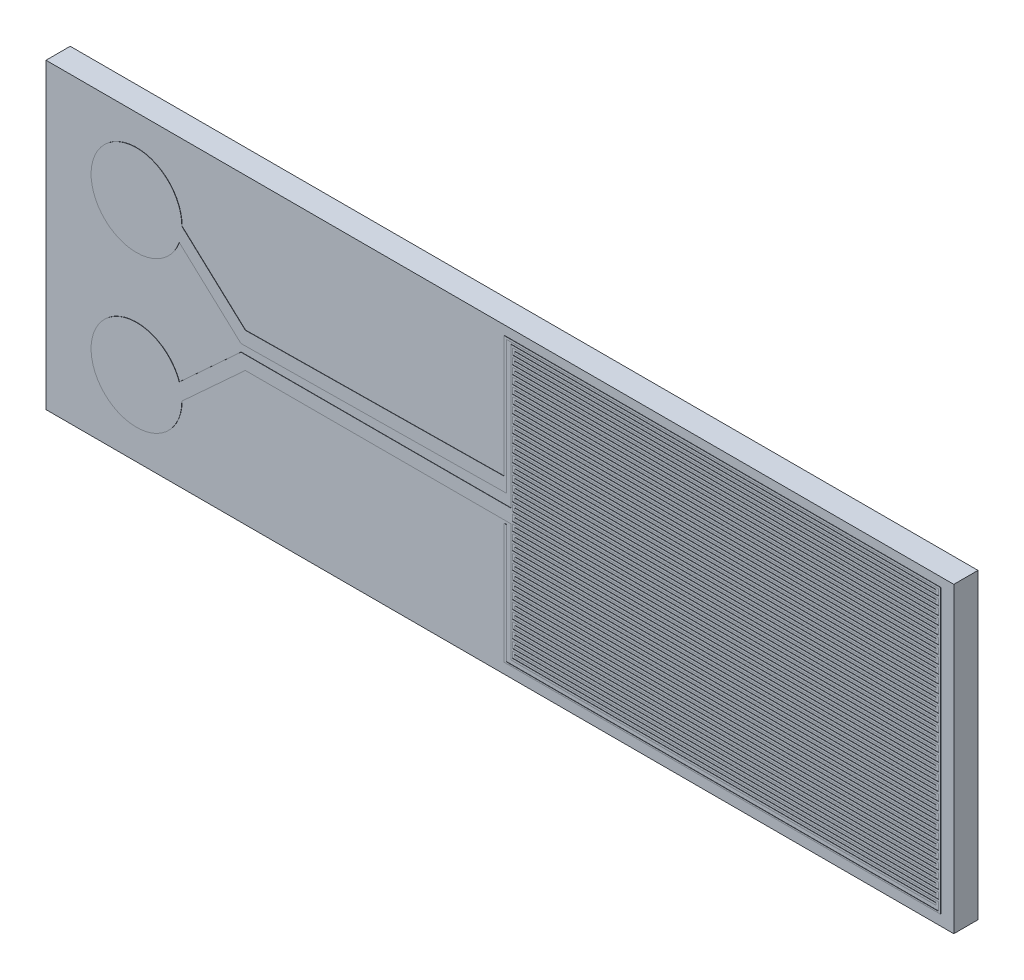
from build123d import *

# Parameters (mm, degrees)
SKETCH_1_W             = 30
SKETCH_1_H             = 10
EXTRUDE_1_DEPTH        = 0.8
SKETCH_2_W             = 14
SKETCH_2_H             = 0.07
EXTRUDE_2_DEPTH        = 0.01
PATTERN_LINEAR_1_COUNT = 33
PATTERN_LINEAR_1_PITCH = 0.28
SKETCH_3_W             = 14
SKETCH_3_H             = 0.07
EXTRUDE_3_DEPTH        = 0.01
PATTERN_LINEAR_2_COUNT = 33
PATTERN_LINEAR_2_PITCH = 0.28
EXTRUDE_4_DEPTH        = 0.01
EXTRUDE_5_DEPTH        = 0.01
EXTRUDE_7_DEPTH        = 0.01
SKETCH_10_W            = 0.01
SKETCH_10_H            = 0.350253409
SKETCH_10_H_2          = 0.1
CUT_EXTRUDE_2_DEPTH    = 0.1
SKETCH_11_R            = 0.65
CUT_EXTRUDE_4_DEPTH    = 32.632894272


with BuildPart() as part:
    # 草图1 → 凸台-拉伸1 (new body)
    with BuildSketch(Plane.XY):
        with Locations((15, 5)):
            Rectangle(SKETCH_1_W, SKETCH_1_H)
    extrude(amount=EXTRUDE_1_DEPTH)

    # 草图2 → 凸台-拉伸2 (add)
    with BuildSketch(Plane.XY.offset(0.8)):
        with Locations((22.5, 9.665)):
            Rectangle(SKETCH_2_W, SKETCH_2_H)
    extrude_2 = extrude(amount=EXTRUDE_2_DEPTH)

    # 阵列(线性)1: 凸台-拉伸2 ×33
    with Locations(*[(0, -i * PATTERN_LINEAR_1_PITCH, 0) for i in range(1, PATTERN_LINEAR_1_COUNT)]):
        add(extrude_2)

    # 草图3 → 凸台-拉伸3 (add)
    with BuildSketch(Plane.XY.offset(0.8)):
        with Locations((22.42, 9.525)):
            Rectangle(SKETCH_3_W, SKETCH_3_H)
    extrude_3 = extrude(amount=EXTRUDE_3_DEPTH)

    # 阵列(线性)2: 凸台-拉伸3 ×33
    with Locations(*[(0, -i * PATTERN_LINEAR_2_PITCH, 0) for i in range(1, PATTERN_LINEAR_2_COUNT)]):
        add(extrude_3)

    # 草图5 → 凸台-拉伸4 (add)
    with BuildSketch(Plane.XY.offset(0.8)):
        Polygon((15.5, 9.7), (15.15, 9.7), (15.15, 9.36), (15.15, 0.57), (15.15, 0.35), (19.5, 0.35), (29.57, 0.35), (29.57, 0.66), (29.57, 9.7), (29.5, 9.7), (29.5, 1.58), (29.5, 1.51), (29.5, 0.4), (15.22, 0.4), (15.22, 9.63), (15.5, 9.63), align=None)
    extrude(amount=EXTRUDE_4_DEPTH)

    # 草图6 → 凸台-拉伸5 (add)
    with BuildSketch(Plane.XY.offset(0.8)):
        Polygon((15.42, 9.49), (15.42, 9.56), (15.37, 9.56), (15.37, 0.53), (15.42, 0.53), align=None)
    extrude(amount=EXTRUDE_5_DEPTH)

    # 草图9 → 凸台-拉伸7 (add)
    with BuildSketch(Plane.XY.offset(0.8)):
        with BuildLine():
            Line((6.451773942, 5.125), (15.15, 5.225253409))
            Line((15.15, 5.225253409), (15.15, 5.675253409))
            Line((15.15, 5.675253409), (6.59668835, 5.575))
            Line((6.59668835, 5.575), (4.5, 7.5))
            ThreePointArc((4.5, 7.5), (1.521893179, 7.755343347), (4.413066367, 6.996767009))
            Line((4.413066367, 6.996767009), (6.451773942, 5.125))
        make_face()
        with BuildLine():
            Line((4.5, 2.5), (6.59668835, 4.425))
            Line((6.59668835, 4.425), (15.37, 4.425))
            Line((15.37, 4.425), (15.37, 4.875))
            Line((15.37, 4.875), (6.451773942, 4.875))
            Line((6.451773942, 4.875), (4.413066367, 3.003232991))
            ThreePointArc((4.413066367, 3.003232991), (1.521893179, 2.244656653), (4.5, 2.5))
        make_face()
    extrude(amount=EXTRUDE_7_DEPTH)

    # 草图10 → 切除-拉伸2 (cut)
    with BuildSketch(Plane.ZY.offset(-15.15)):
        with Locations((0.805, 5.050126705)):
            Rectangle(SKETCH_10_W, SKETCH_10_H)
        with Locations((0.805, 4.375)):
            Rectangle(SKETCH_10_W, SKETCH_10_H_2)
    extrude(amount=-CUT_EXTRUDE_2_DEPTH, mode=Mode.SUBTRACT)

    # 草图11 → 切除-拉伸4 (cut, through all)
    with BuildSketch(Plane.XY.offset(0.8)):
        with Locations((3, 2.5)):
            Circle(SKETCH_11_R)
    extrude(amount=-CUT_EXTRUDE_4_DEPTH, mode=Mode.SUBTRACT)


solid = part.part
